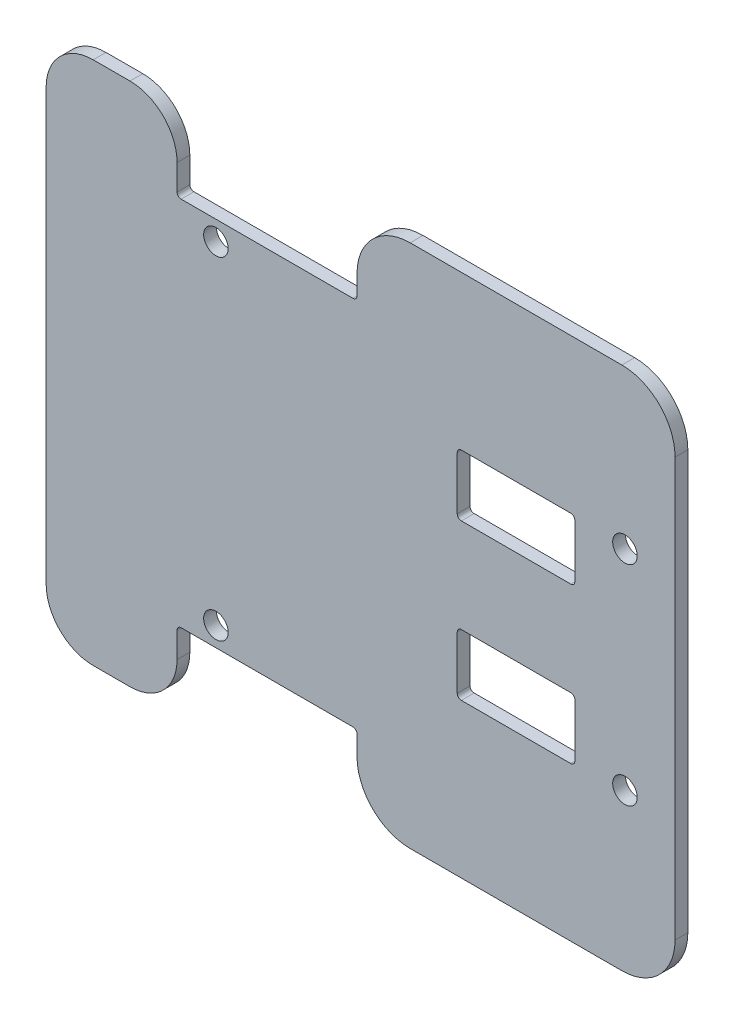
from build123d import *

# Parameters (mm, degrees)
SKETCH2_W           = 14.605
SKETCH2_H           = 7.62
BOSS_EXTRUDE1_DEPTH = 1.5875
SKETCH3_R           = 1.524
CUT_EXTRUDE1_DEPTH  = 68.907542479
FILLET1_R           = 0.508
FILLET2_R           = 6.604


with BuildPart() as part:
    # Sketch2 → Boss-Extrude1 (new body)
    with BuildSketch(Plane.XY):
        with BuildLine():
            Line((-2.286, 26.7335), (-2.286, 23.0505))
            Line((-2.286, 23.0505), (18.796, 23.0505))
            Line((18.796, 23.0505), (20.066, 23.0505))
            Line((20.066, 23.0505), (20.066, 32.5755))
            Line((20.066, 32.5755), (59.563, 32.5755))
            Line((59.563, 32.5755), (59.563, 13.462))
            Line((59.563, 13.462), (59.563, -13.462))
            Line((59.563, -13.462), (59.563, -32.5755))
            Line((59.563, -32.5755), (20.066, -32.5755))
            Line((20.066, -32.5755), (20.066, -23.0505))
            Line((20.066, -23.0505), (18.796, -23.0505))
            Line((18.796, -23.0505), (-2.286, -23.0505))
            Line((-2.286, -23.0505), (-2.286, -26.7335))
            ThreePointArc((-2.286, -26.7335), (-3.997082184, -30.864417816), (-8.128, -32.5755))
            Line((-8.128, -32.5755), (-12.7, -32.5755))
            ThreePointArc((-12.7, -32.5755), (-16.830917816, -30.864417816), (-18.542, -26.7335))
            Line((-18.542, -26.7335), (-18.542, 26.7335))
            ThreePointArc((-18.542, 26.7335), (-16.830917816, 30.864417816), (-12.7, 32.5755))
            Line((-12.7, 32.5755), (-8.128, 32.5755))
            ThreePointArc((-8.128, 32.5755), (-3.997082184, 30.864417816), (-2.286, 26.7335))
        make_face()
        with Locations((39.8145, -9.652)):
            Rectangle(SKETCH2_W, SKETCH2_H, mode=Mode.SUBTRACT)
        with Locations((39.8145, 9.652)):
            Rectangle(SKETCH2_W, SKETCH2_H, mode=Mode.SUBTRACT)
    extrude(amount=BOSS_EXTRUDE1_DEPTH)

    # Sketch3 → Cut-Extrude1 (cut, through all)
    with BuildSketch(Plane(origin=(0, 0, 0), x_dir=(-1, 0, 0), z_dir=(0, 0, -1))):
        with Locations((-53.34, 12.98575)):
            Circle(SKETCH3_R)
        with Locations(Location((-53.34, -12.98575, 0), (0, 0, 180))):
            Circle(SKETCH3_R)
        with Locations((-2.54, 20.6375)):
            Circle(SKETCH3_R)
        with Locations(Location((-2.54, -20.6375, 0), (0, 0, 180))):
            Circle(SKETCH3_R)
    extrude(amount=-CUT_EXTRUDE1_DEPTH, mode=Mode.SUBTRACT)

    # Fillet1
    fillet1_edges = [part.edges().sort_by_distance(p)[0] for p in [
        (-2.286, -23.0505, 0.79375),
        (-2.286, 23.0505, 0.79375),
        (20.066, 23.0505, 0.79375),
        (20.066, -23.0505, 0.79375),
        (32.512, 13.462, 0.79375),
        (32.512, 5.842, 0.79375),
        (47.117, 5.842, 0.79375),
        (47.117, 13.462, 0.79375),
        (47.117, -5.842, 0.79375),
        (32.512, -5.842, 0.79375),
        (32.512, -13.462, 0.79375),
        (47.117, -13.462, 0.79375),
    ]]
    fillet(fillet1_edges, radius=FILLET1_R)

    # Fillet2
    fillet2_edges = [part.edges().sort_by_distance(p)[0] for p in [
        (20.066, 32.5755, 0.79375),
        (59.563, 32.5755, 0.79375),
        (59.563, -32.5755, 0.79375),
        (20.066, -32.5755, 0.79375),
    ]]
    fillet(fillet2_edges, radius=FILLET2_R)


solid = part.part
